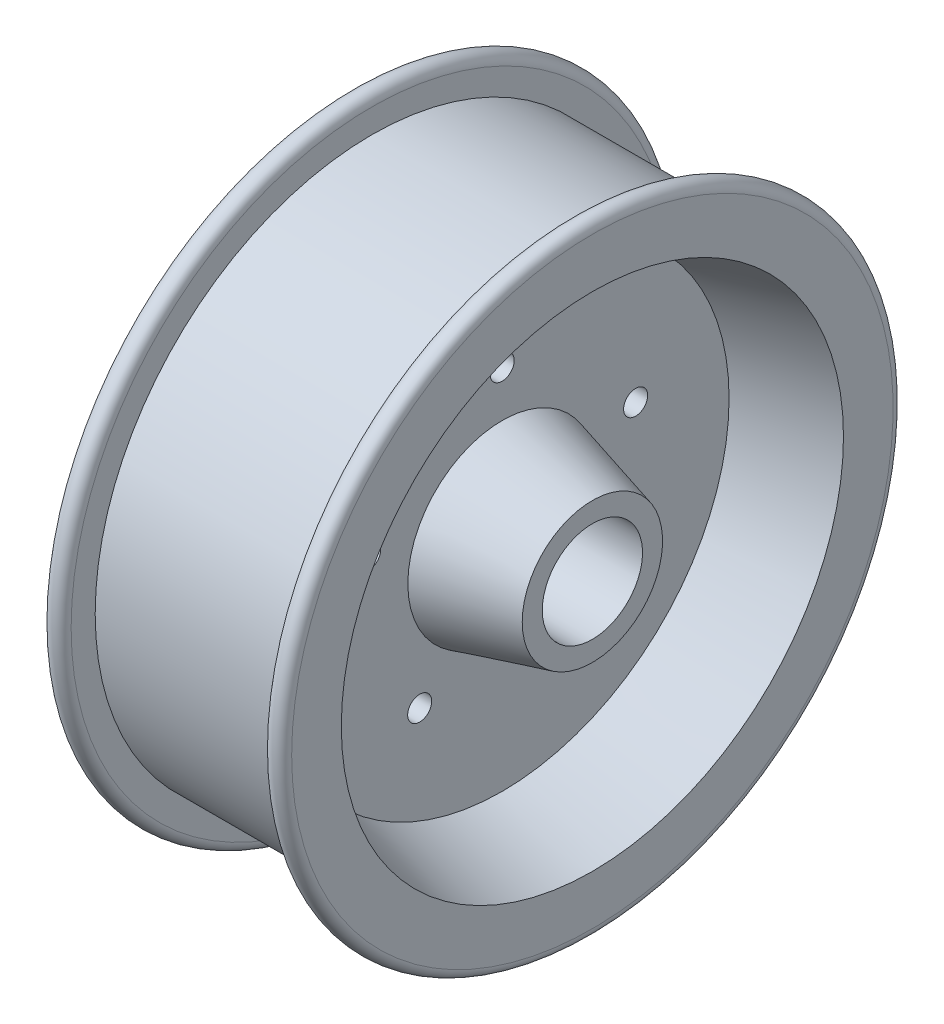
from build123d import *

# Parameters (mm, degrees)
SKETCH2_R          = 3.81
CUT_EXTRUDE1_DEPTH = 148.115947179


with BuildPart() as part:
    # Sketch1 → Revolve1 (revolve)
    with BuildSketch(Plane.XY, mode=Mode.PRIVATE) as revolve1_sk:
        with BuildLine():
            ThreePointArc((-38.1, 95.25), (-34.925, 98.425), (-31.75, 95.25))
            Line((-31.75, 95.25), (-31.75, 87.63))
            Line((-31.75, 87.63), (31.75, 87.63))
            Line((31.75, 87.63), (31.75, 95.25))
            ThreePointArc((31.75, 95.25), (34.925, 98.425), (38.1, 95.25))
            Line((38.1, 95.25), (38.1, 79.5274))
            Line((38.1, 79.5274), (9.525, 71.870751826))
            Line((9.525, 71.870751826), (9.525, 29.881648174))
            Line((9.525, 29.881648174), (38.1, 22.225))
            Line((38.1, 22.225), (38.1, 15.875))
            Line((38.1, 15.875), (-38.1, 15.875))
            Line((-38.1, 15.875), (-38.1, 22.225))
            Line((-38.1, 22.225), (-9.525, 29.881648174))
            Line((-9.525, 29.881648174), (-9.525, 71.870751826))
            Line((-9.525, 71.870751826), (-38.1, 79.5274))
            Line((-38.1, 79.5274), (-38.1, 95.25))
        make_face()
    revolve(revolve1_sk.sketch.rotate(Axis((-74.767669173, 0, 0), (1, 0, 0)), 90), axis=Axis((-74.767669173, 0, 0), (1, 0, 0)))

    # Sketch2 → Cut-Extrude1 (cut, through all)
    with BuildSketch(Plane(origin=(9.525, 0, 0), x_dir=(0, 0, -1), z_dir=(1, 0, 0))):
        with Locations((0, 44.45)):
            Circle(SKETCH2_R)
        with Locations((42.274462149, 13.7358054)):
            Circle(SKETCH2_R)
        with Locations((26.127054464, -35.9608054)):
            Circle(SKETCH2_R)
        with Locations((-26.127054464, -35.9608054)):
            Circle(SKETCH2_R)
        with Locations((-42.274462149, 13.7358054)):
            Circle(SKETCH2_R)
    extrude(amount=-CUT_EXTRUDE1_DEPTH, mode=Mode.SUBTRACT)


solid = part.part
